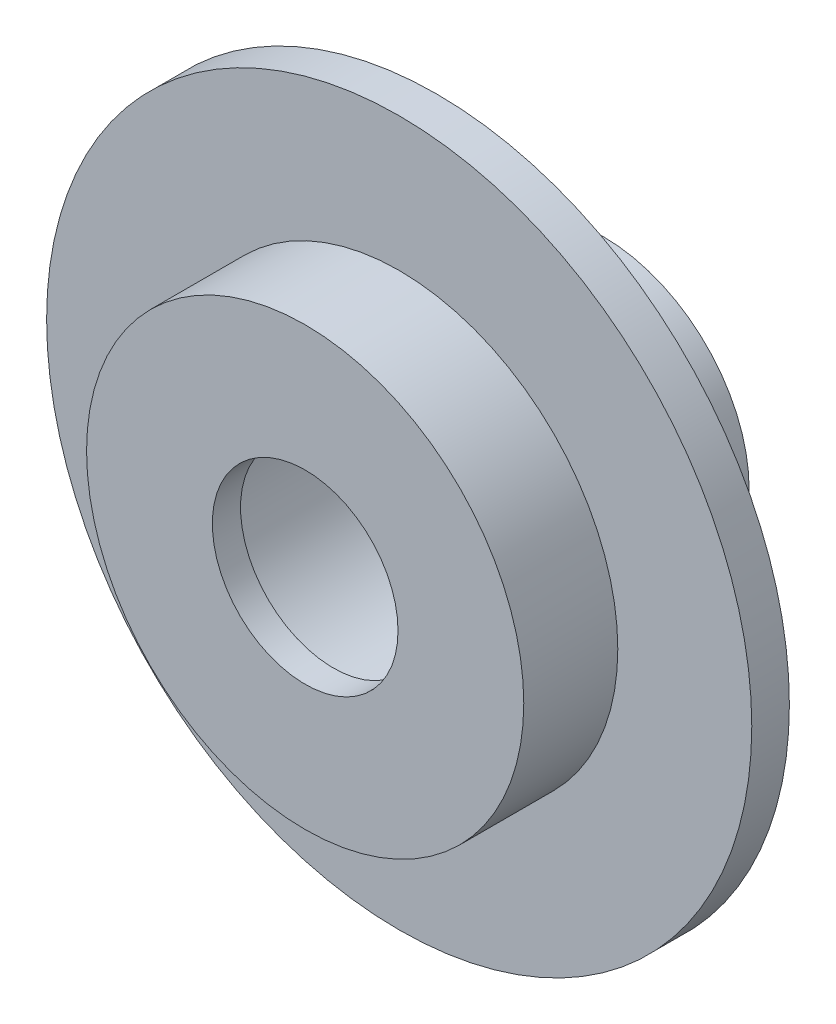
from build123d import *

# Parameters (mm, degrees)
ESQUISSE1_R             = 19.05
BOSS_EXTRU_1_DEPTH      = 2.032
ESQUISSE2_R             = 11.811
BOSS_EXTRU_2_DEPTH      = 5.08
ESQUISSE3_R             = 5.0165
ENL_V_MAT_EXTRU_1_DEPTH = 1.524
ESQUISSE4_R             = 7.875
BOSS_EXTRU_3_DEPTH      = 9
ESQUISSE5_R             = 6.875
ENL_V_MAT_EXTRU_2_DEPTH = 14.588


with BuildPart() as part:
    # Esquisse1 → Boss.-Extru.1 (new body)
    with BuildSketch(Plane.XY):
        Circle(ESQUISSE1_R)
    extrude(amount=BOSS_EXTRU_1_DEPTH)

    # Esquisse2 → Boss.-Extru.2 (add)
    with BuildSketch(Plane.XY.offset(2.032)):
        Circle(ESQUISSE2_R)
    extrude(amount=BOSS_EXTRU_2_DEPTH)

    # Esquisse3 → Enlèv. mat.-Extru.1 (cut)
    with BuildSketch(Plane.XY.offset(7.112)):
        Circle(ESQUISSE3_R)
    extrude(amount=-ENL_V_MAT_EXTRU_1_DEPTH, mode=Mode.SUBTRACT)

    # Esquisse4 → Boss.-Extru.3 (add)
    with BuildSketch(Plane(origin=(0, 0, 0), x_dir=(-1, 0, 0), z_dir=(0, 0, -1))):
        with Locations(Location((0, 0, 0), (0, 0, 180))):
            Circle(ESQUISSE4_R)
    extrude(amount=BOSS_EXTRU_3_DEPTH)

    # Esquisse5 → Enlèv. mat.-Extru.2 (cut)
    with BuildSketch(Plane(origin=(0, 0, -9), x_dir=(-1, 0, 0), z_dir=(0, 0, -1))):
        Circle(ESQUISSE5_R)
    extrude(amount=-ENL_V_MAT_EXTRU_2_DEPTH, mode=Mode.SUBTRACT)


solid = part.part
